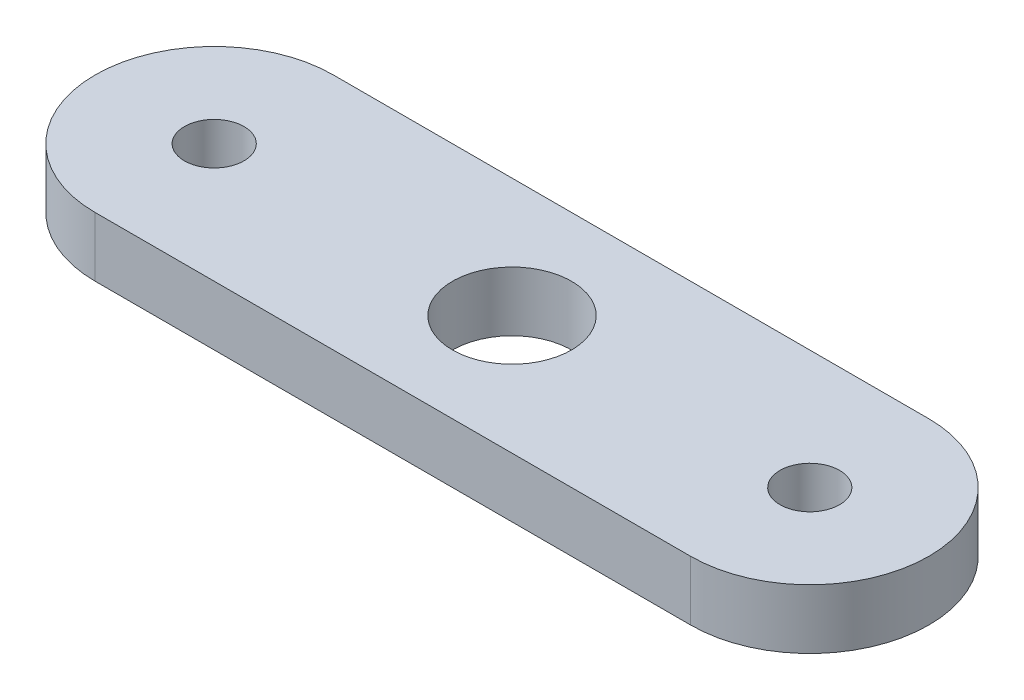
from build123d import *

# Parameters (mm, degrees)
SKETCH2_R           = 5
SKETCH2_R_2         = 10
BOSS_EXTRUDE1_DEPTH = 10
SCALE2_SCALE        = 0.2004


with BuildPart() as part:
    # Sketch2 → Boss-Extrude1 (new body)
    with BuildSketch(Plane(origin=(0, 0, 0), x_dir=(1, 0, 0), z_dir=(0, 1, 0))):
        with BuildLine():
            Line((-50, 20), (50, 20))
            ThreePointArc((50, 20), (70, 0), (50, -20))
            Line((50, -20), (-50, -20))
            ThreePointArc((-50, -20), (-70, 0), (-50, 20))
        make_face()
        with Locations(Location((50, 0, 0), (0, 0, 270))):
            Circle(SKETCH2_R, mode=Mode.SUBTRACT)
        with Locations(Location((-50, 0, 0), (0, 0, 270))):
            Circle(SKETCH2_R, mode=Mode.SUBTRACT)
        with Locations(Location((0, 0, 0), (0, 0, 270))):
            Circle(SKETCH2_R_2, mode=Mode.SUBTRACT)
    extrude(amount=BOSS_EXTRUDE1_DEPTH)


with BuildPart() as part_1:
    # Scale2: scaled about (0, 5, 0)
    add(part.part.scale(SCALE2_SCALE).moved(Location((0, 3.998, 0))))


solid = part_1.part
